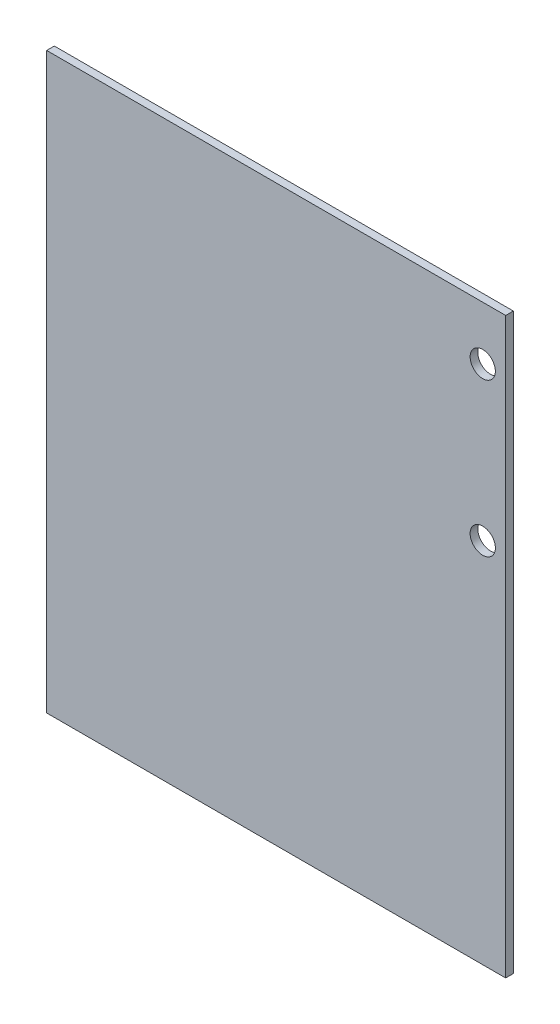
from build123d import *

# Parameters (mm, degrees)
SKETCH_1_W          = 60
SKETCH_1_H          = 75
EXTRUDE_1_DEPTH     = 1
SKETCH_3_R          = 1.65
CUT_EXTRUDE_1_DEPTH = 49.033842236


with BuildPart() as part:
    # 草图1 → 凸台-拉伸1 (new body)
    with BuildSketch(Plane.XY):
        Rectangle(SKETCH_1_W, SKETCH_1_H)
    extrude(amount=EXTRUDE_1_DEPTH)

    # 草图3 → 切除-拉伸1 (cut, through all)
    with BuildSketch(Plane.XY.offset(1)):
        with Locations((27, 30.5)):
            Circle(SKETCH_3_R)
        with Locations((27, 10.5)):
            Circle(SKETCH_3_R)
    extrude(amount=-CUT_EXTRUDE_1_DEPTH, mode=Mode.SUBTRACT)


solid = part.part
